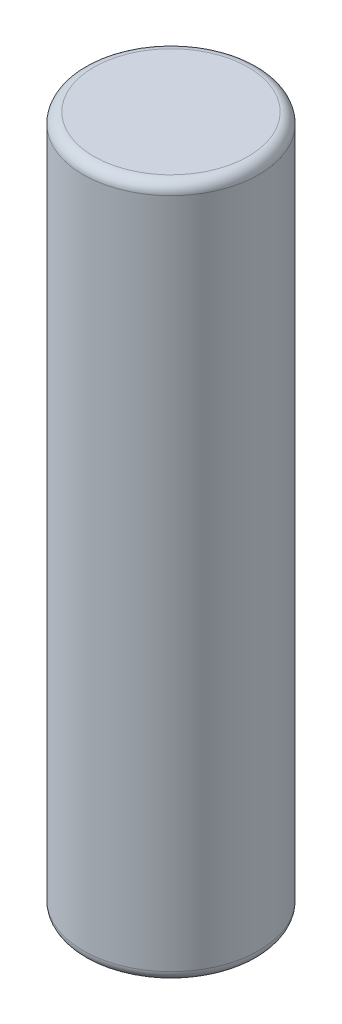
from build123d import *

# Parameters (mm, degrees)
CROQUIS1_R              = 8.3
SALIENTE_EXTRUIR1_DEPTH = 65.5
REDONDEO3_R             = 1


with BuildPart() as part:
    # Croquis1 → Saliente-Extruir1 (new body)
    with BuildSketch(Plane(origin=(0, 0, 0), x_dir=(1, 0, 0), z_dir=(0, 1, 0))):
        with Locations(Location((0, 0, 0), (0, 0, 270))):
            Circle(CROQUIS1_R)
    extrude(amount=SALIENTE_EXTRUIR1_DEPTH)

    # Redondeo3
    redondeo3_edges = [part.edges().sort_by_distance(p)[0] for p in [
        (0, 0, -8.3),
        (0, 65.5, -8.3),
    ]]
    fillet(redondeo3_edges, radius=REDONDEO3_R)


solid = part.part
